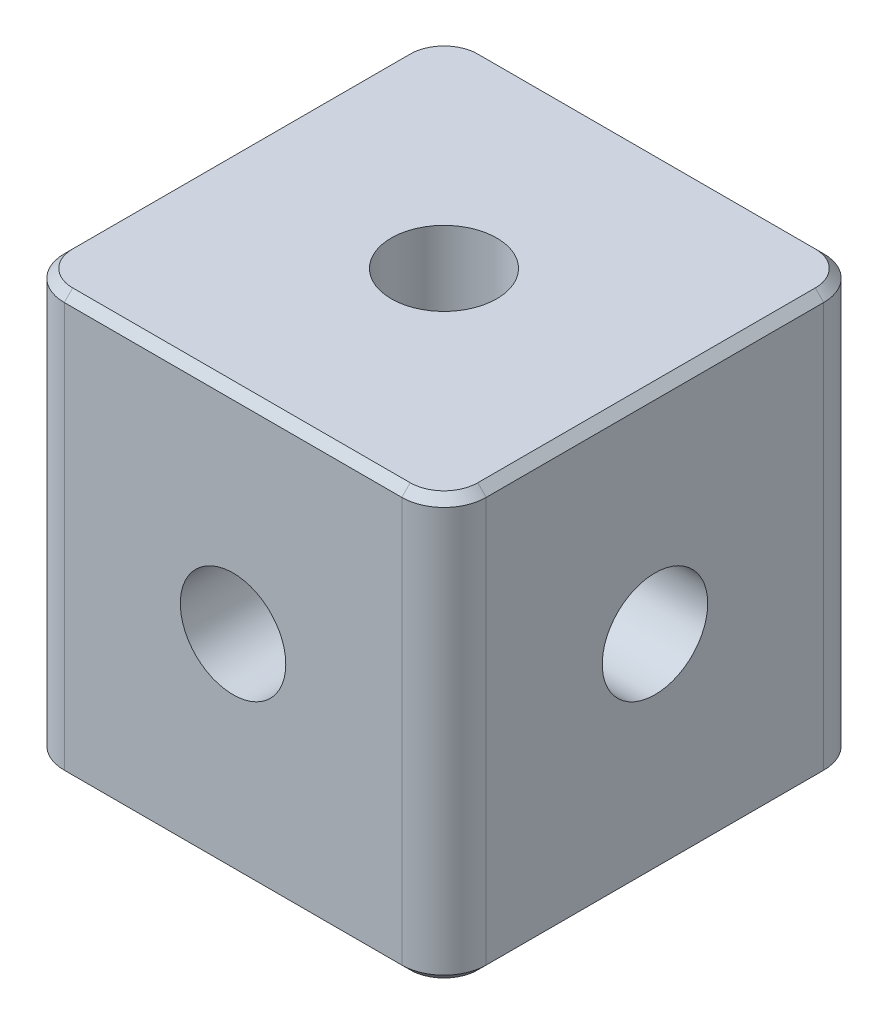
from build123d import *

# Parameters (mm, degrees)
SKETCH_1_W         = 10
SKETCH_1_H         = 10
EXTRUDE_1_DEPTH    = 5
HOLE_WIZARD_M3_1_D = 2.5
HOLE_WIZARD_M3_2_D = 2.5
HOLE_WIZARD_M3_3_D = 2.5
FILLET_1_R         = 1
CHAMFER_1_SIZE     = 0.2


with BuildPart() as part:
    # 草图1 → 凸台-拉伸1 (new, symmetric)
    with BuildSketch(Plane(origin=(0, 0, 0), x_dir=(1, 0, 0), z_dir=(0, 1, 0))):
        Rectangle(SKETCH_1_W, SKETCH_1_H)
    extrude(amount=EXTRUDE_1_DEPTH, both=True)

    # M3 螺纹孔1 (through all)
    with Locations(Plane(origin=(0, 5, 0), x_dir=(1, 0, 0), z_dir=(0, 1, 0))):
        with Locations((0, 0)):
            Hole(HOLE_WIZARD_M3_1_D / 2)

    # M3 螺纹孔2 (through all)
    with Locations(Plane.XY.offset(5)):
        with Locations((0, 0)):
            Hole(HOLE_WIZARD_M3_2_D / 2)

    # M3 螺纹孔3 (through all)
    with Locations(Plane(origin=(5, 0, 0), x_dir=(0, 0, -1), z_dir=(1, 0, 0))):
        with Locations((0, 0)):
            Hole(HOLE_WIZARD_M3_3_D / 2)

    # 圆角1
    fillet_1_edges = [part.edges().sort_by_distance(p)[0] for p in [
        (5, 0, 5),
        (-5, 0, 5),
        (-5, 0, -5),
        (5, 0, -5),
    ]]
    fillet(fillet_1_edges, radius=FILLET_1_R)

    # 倒角1
    chamfer_1_edges = [part.edges().sort_by_distance(p)[0] for p in [
        (0, -5, -5),
        (0, 5, -5),
        (5, -5, 0),
        (0, -5, 5),
        (-5, -5, 0),
        (-4.707106781, -5, -4.707106781),
        (-4.707106781, -5, 4.707106781),
        (4.707106781, -5, 4.707106781),
        (4.707106781, -5, -4.707106781),
        (5, 5, 0),
        (-5, 5, 0),
        (0, 5, 5),
        (-4.707106781, 5, -4.707106781),
        (-4.707106781, 5, 4.707106781),
        (4.707106781, 5, 4.707106781),
        (4.707106781, 5, -4.707106781),
    ]]
    chamfer(chamfer_1_edges, length=CHAMFER_1_SIZE)


solid = part.part
